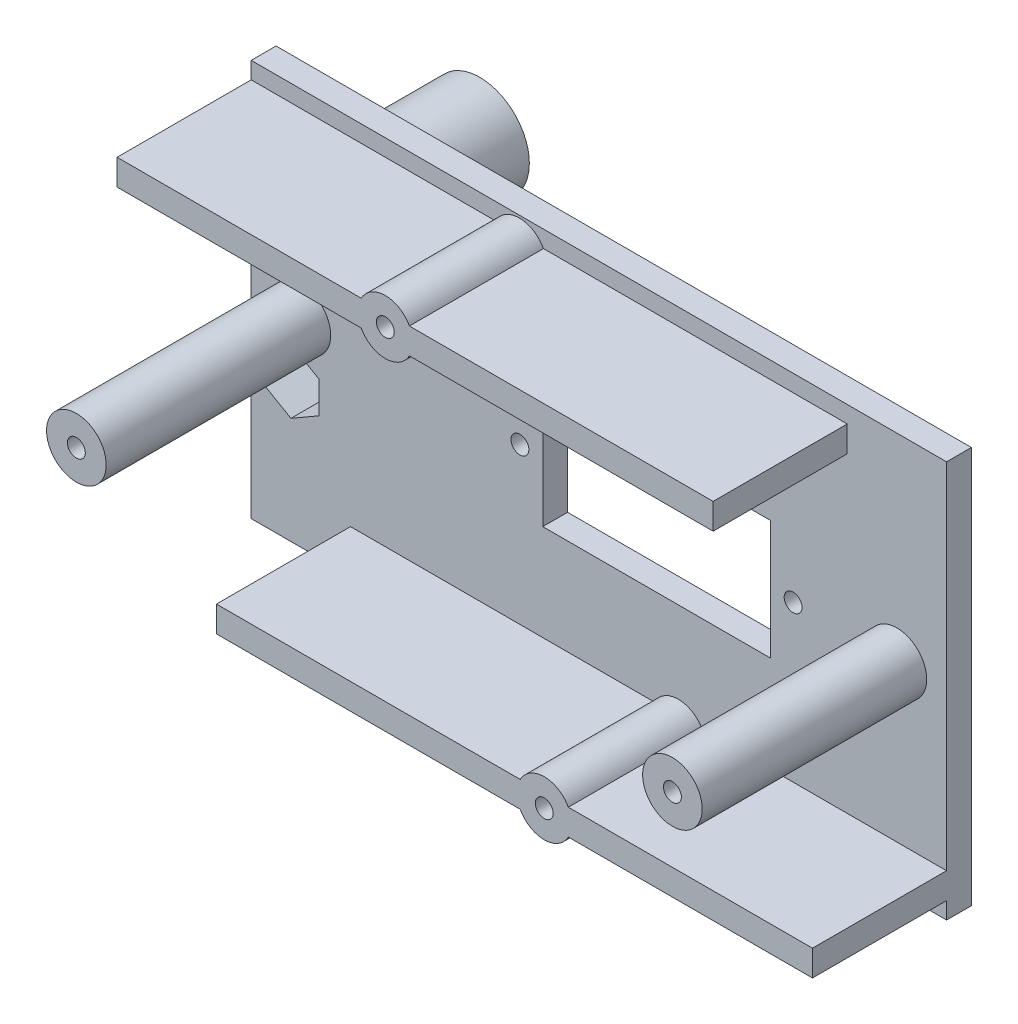
from build123d import *

# Parameters (mm, degrees)
BOSS_EXTRUDE1_START     = -2.5
SKETCH1_W               = 70
SKETCH1_H               = 39.95
BOSS_EXTRUDE1_DEPTH     = 2.5
SKETCH2_W               = 60
SKETCH2_H               = 2.6
BOSS_EXTRUDE2_DEPTH     = 13.5
SKETCH3_W               = 60
SKETCH3_H               = 2.6
BOSS_EXTRUDE3_DEPTH     = 13.5
SKETCH4_R               = 2.75
BOSS_EXTRUDE4_DEPTH     = 13.5
BOSS_EXTRUDE5_START     = -19
SKETCH5_R               = 5
BOSS_EXTRUDE5_DEPTH     = 16.5
SKETCH6_R               = 3
BOSS_EXTRUDE6_DEPTH     = 22.6
CUT_EXTRUDE1_START      = 14.6
SKETCH7_R               = 0.9
CUT_EXTRUDE1_DEPTH      = 8.1
CUT_EXTRUDE2_DEPTH      = 47.965525921
CUT_EXTRUDE2_DEPTH_BACK = 47.965525921
SKETCH8_W               = 22.9
SKETCH8_H               = 12
CUT_EXTRUDE3_DEPTH      = 47.965525921
CUT_EXTRUDE3_DEPTH_BACK = 47.965525921
SKETCH9_R               = 0.9
CUT_EXTRUDE4_DEPTH      = 47.965525921
CUT_EXTRUDE4_DEPTH_BACK = 47.965525921
SKETCH10_R              = 0.9
CUT_EXTRUDE5_DEPTH      = 47.965525921
CUT_EXTRUDE5_DEPTH_BACK = 47.965525921
SKETCH11_R              = 1.725
CUT_EXTRUDE6_START      = -4.2
CUT_EXTRUDE6_DEPTH      = 4.2


with BuildPart() as part:
    # Sketch1 → Boss-Extrude1 (new body)
    with BuildSketch(Plane.XY.offset(BOSS_EXTRUDE1_START)):
        Rectangle(SKETCH1_W, SKETCH1_H)
    extrude(amount=BOSS_EXTRUDE1_DEPTH)

    # Sketch2 → Boss-Extrude2 (add)
    with BuildSketch(Plane.XY):
        with Locations((-5, 16.975)):
            Rectangle(SKETCH2_W, SKETCH2_H)
    extrude(amount=BOSS_EXTRUDE2_DEPTH)

    # Sketch3 → Boss-Extrude3 (add)
    with BuildSketch(Plane.XY):
        with Locations((5, -16.975)):
            Rectangle(SKETCH3_W, SKETCH3_H)
    extrude(amount=BOSS_EXTRUDE3_DEPTH)

    # Sketch4 → Boss-Extrude4 (add)
    with BuildSketch(Plane.XY):
        with Locations((-8, 16.975)):
            Circle(SKETCH4_R)
        with Locations((8, -16.975)):
            Circle(SKETCH4_R)
    extrude(amount=BOSS_EXTRUDE4_DEPTH)

    # Sketch5 → Boss-Extrude5 (add)
    with BuildSketch(Plane.XY.offset(BOSS_EXTRUDE5_START)):
        with Locations(Location((-31, 6, 0), (0, 0, 143.130102354))):
            Circle(SKETCH5_R)
        with Locations(Location((-31, -6, 0), (0, 0, 143.130102354))):
            Circle(SKETCH5_R)
    extrude(amount=BOSS_EXTRUDE5_DEPTH)

    # Sketch6 → Boss-Extrude6 (add)
    with BuildSketch(Plane.XY):
        with Locations((30, 0)):
            Circle(SKETCH6_R)
        with Locations((-30, 0)):
            Circle(SKETCH6_R)
    extrude(amount=BOSS_EXTRUDE6_DEPTH)

    # Sketch7 → Cut-Extrude1 (cut)
    with BuildSketch(Plane.XY.offset(CUT_EXTRUDE1_START)):
        with Locations((30, 0)):
            Circle(SKETCH7_R)
        with Locations((-30, 0)):
            Circle(SKETCH7_R)
    extrude(amount=CUT_EXTRUDE1_DEPTH, mode=Mode.SUBTRACT)

    # Sketch8 → Cut-Extrude2 (cut, two sides: drawn at the far end of the back side and taken through both)
    with BuildSketch(Plane.XY.offset(-CUT_EXTRUDE2_DEPTH_BACK)):
        with Locations((5.8, 0)):
            Rectangle(SKETCH8_W, SKETCH8_H)
    extrude(amount=CUT_EXTRUDE2_DEPTH + CUT_EXTRUDE2_DEPTH_BACK, mode=Mode.SUBTRACT)

    # Sketch9 → Cut-Extrude3 (cut, two sides: drawn at the far end of the back side and taken through both)
    with BuildSketch(Plane.XY.offset(-CUT_EXTRUDE3_DEPTH_BACK)):
        with Locations((-7.95, 0)):
            Circle(SKETCH9_R)
        with Locations((19.55, 0)):
            Circle(SKETCH9_R)
    extrude(amount=CUT_EXTRUDE3_DEPTH + CUT_EXTRUDE3_DEPTH_BACK, mode=Mode.SUBTRACT)

    # Sketch10 → Cut-Extrude4 (cut, two sides: drawn at the far end of the back side and taken through both)
    with BuildSketch(Plane.XY.offset(-CUT_EXTRUDE4_DEPTH_BACK)):
        with Locations((-8, 16.975)):
            Circle(SKETCH10_R)
        with Locations((8, -16.975)):
            Circle(SKETCH10_R)
    extrude(amount=CUT_EXTRUDE4_DEPTH + CUT_EXTRUDE4_DEPTH_BACK, mode=Mode.SUBTRACT)

    # Sketch11 → Cut-Extrude5 (cut, two sides: drawn at the far end of the back side and taken through both)
    with BuildSketch(Plane.XY.offset(-CUT_EXTRUDE5_DEPTH_BACK)):
        with Locations((-31, 6)):
            Circle(SKETCH11_R)
        with Locations((-31, -6)):
            Circle(SKETCH11_R)
    extrude(amount=CUT_EXTRUDE5_DEPTH + CUT_EXTRUDE5_DEPTH_BACK, mode=Mode.SUBTRACT)

    # Sketch12 → Cut-Extrude6 (cut)
    with BuildSketch(Plane.XY.offset(CUT_EXTRUDE6_START)):
        Polygon((-28.2, 7.616580754), (-31, 9.233161507), (-33.8, 7.616580754), (-33.8, 4.383419246), (-31, 2.766838493), (-28.2, 4.383419246), align=None)
        Polygon((-28.2, -4.383419246), (-31, -2.766838493), (-33.8, -4.383419246), (-33.8, -7.616580754), (-31, -9.233161507), (-28.2, -7.616580754), align=None)
    extrude(amount=CUT_EXTRUDE6_DEPTH, mode=Mode.SUBTRACT)


solid = part.part
